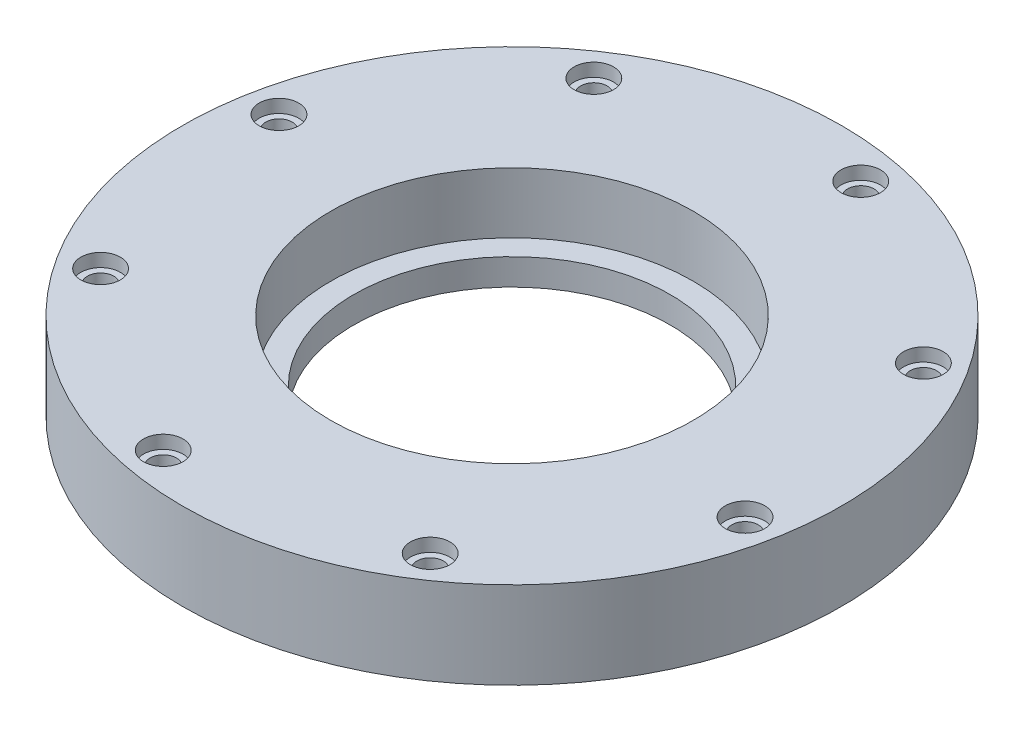
from build123d import *

# Parameters (mm, degrees)
SKETCH1_R           = 50
SKETCH1_R_2         = 24
BOSS_EXTRUDE1_DEPTH = 13.2
SKETCH2_R           = 2
CUT_EXTRUDE3_DEPTH  = 13.2
SKETCH2_6_R         = 3
CUT_EXTRUDE4_DEPTH  = 2
CIRPATTERN2_COUNT   = 8
CIRPATTERN3_COUNT   = 8
SKETCH3_R           = 2.75
CUT_EXTRUDE5_DEPTH  = 4.2
CIRPATTERN4_COUNT   = 16
CUT_EXTRUDE9_START  = -9.2
SKETCH5_R           = 27.5
SKETCH5_R_2         = 24
CUT_EXTRUDE9_DEPTH  = 9.2


with BuildPart() as part:
    # Sketch1 → Boss-Extrude1 (new body)
    with BuildSketch(Plane(origin=(0, 0, 0), x_dir=(1, 0, 0), z_dir=(0, 1, 0))):
        Circle(SKETCH1_R)
        Circle(SKETCH1_R_2, mode=Mode.SUBTRACT)
    extrude(amount=BOSS_EXTRUDE1_DEPTH)

    # Sketch2 → Cut-Extrude3 (cut)
    with BuildSketch(Plane(origin=(0, 13.2, 0), x_dir=(1, 0, 0), z_dir=(0, 1, 0))):
        with Locations((37.416132554, 25.000660486)):
            Circle(SKETCH2_R)
    cut_extrude3 = extrude(amount=-CUT_EXTRUDE3_DEPTH, mode=Mode.SUBTRACT)

    # Sketch2<6> → Cut-Extrude4 (cut)
    with BuildSketch(Plane(origin=(0, 13.2, 0), x_dir=(1, 0, 0), z_dir=(0, 1, 0))):
        with Locations((37.416132554, 25.000660486)):
            Circle(SKETCH2_6_R)
    cut_extrude4 = extrude(amount=-CUT_EXTRUDE4_DEPTH, mode=Mode.SUBTRACT)

    # CirPattern2: Cut-Extrude3 ×8 about axis
    cirpattern2_axis = Axis((0, 13.2, 0), (0, 1, 0))
    for i in range(1, CIRPATTERN2_COUNT):
        add(cut_extrude3.rotate(cirpattern2_axis, i * 360 / CIRPATTERN2_COUNT), mode=Mode.SUBTRACT)

    # CirPattern3: Cut-Extrude4 ×8 about axis
    cirpattern3_axis = Axis((0, 13.2, 0), (0, 1, 0))
    for i in range(1, CIRPATTERN3_COUNT):
        add(cut_extrude4.rotate(cirpattern3_axis, i * 360 / CIRPATTERN3_COUNT), mode=Mode.SUBTRACT)

    # Sketch3 → Cut-Extrude5 (cut)
    with BuildSketch(Plane.XZ):
        with Locations((0, 35)):
            Circle(SKETCH3_R)
    cut_extrude5 = extrude(amount=-CUT_EXTRUDE5_DEPTH, mode=Mode.SUBTRACT)

    # CirPattern4: Cut-Extrude5 ×16 about axis
    cirpattern4_axis = Axis((0, 0, 0), (0, 1, 0))
    for i in range(1, CIRPATTERN4_COUNT):
        add(cut_extrude5.rotate(cirpattern4_axis, i * 360 / CIRPATTERN4_COUNT), mode=Mode.SUBTRACT)

    # Sketch5 → Cut-Extrude9 (cut)
    with BuildSketch(Plane(origin=(0, 13.2, 0), x_dir=(1, 0, 0), z_dir=(0, 1, 0)).offset(CUT_EXTRUDE9_START)):
        Circle(SKETCH5_R)
        Circle(SKETCH5_R_2, mode=Mode.SUBTRACT)
    extrude(amount=CUT_EXTRUDE9_DEPTH, mode=Mode.SUBTRACT)


solid = part.part
